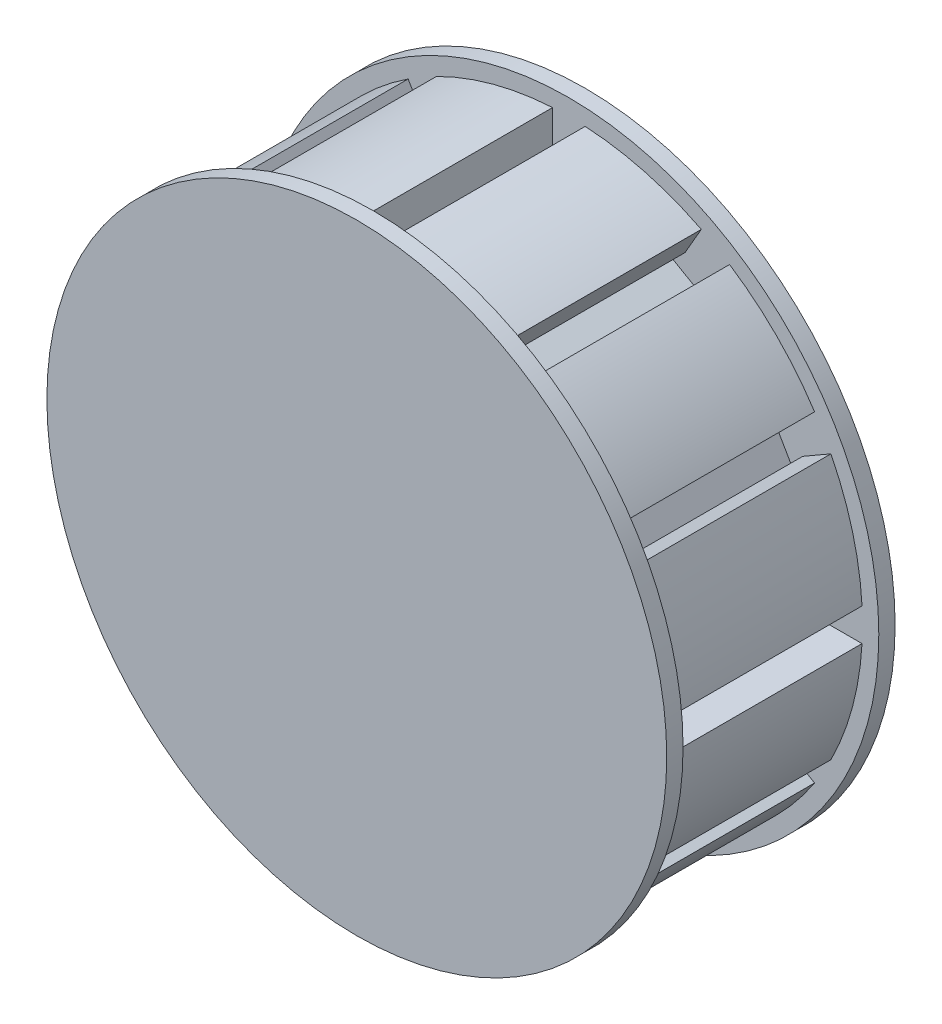
from build123d import *

# Parameters (mm, degrees)
SKETCH1_R           = 28.575
BOSS_EXTRUDE1_DEPTH = 9.525
CUT_EXTRUDE1_DEPTH  = 9.525
CIRPATTERN1_COUNT   = 12
SKETCH3_R           = 30.1625
BOSS_EXTRUDE2_DEPTH = 1.5875


with BuildPart() as part:
    # Sketch1 → Boss-Extrude1 (new, symmetric)
    with BuildSketch(Plane.XY):
        with Locations(Location((0, 0, 0), (0, 0, 180))):
            Circle(SKETCH1_R)
    extrude(amount=BOSS_EXTRUDE1_DEPTH, both=True)

    # Sketch2 → Cut-Extrude1 (cut, symmetric)
    with BuildSketch(Plane.XY):
        with BuildLine():
            Line((-1.5875, 28.5308687), (-1.5875, 25.3558687))
            Line((-1.5875, 25.3558687), (-4.7625, 25.3558687))
            Line((-4.7625, 25.3558687), (-4.7625, 23.7683687))
            Line((-4.7625, 23.7683687), (4.7625, 23.7683687))
            Line((4.7625, 23.7683687), (4.7625, 25.3558687))
            Line((4.7625, 25.3558687), (1.5875, 25.3558687))
            Line((1.5875, 25.3558687), (1.5875, 28.5308687))
            ThreePointArc((1.5875, 28.5308687), (0, 28.575), (-1.5875, 28.5308687))
        make_face()
    cut_extrude1 = extrude(amount=CUT_EXTRUDE1_DEPTH, both=True, mode=Mode.SUBTRACT)

    # CirPattern1: Cut-Extrude1 ×12 about axis
    cirpattern1_axis = Axis((0, 0, 0), (0, 0, 1))
    for i in range(1, CIRPATTERN1_COUNT):
        add(cut_extrude1.rotate(cirpattern1_axis, i * 360 / CIRPATTERN1_COUNT), mode=Mode.SUBTRACT)

    # Sketch3 → Boss-Extrude2 (add)
    with BuildSketch(Plane(origin=(0, 0, -9.525), x_dir=(-1, 0, 0), z_dir=(0, 0, -1))):
        Circle(SKETCH3_R)
    boss_extrude2 = extrude(amount=BOSS_EXTRUDE2_DEPTH)

    # Mirror1: Boss-Extrude2 across plane
    add(boss_extrude2.mirror(Plane.XY))


solid = part.part
